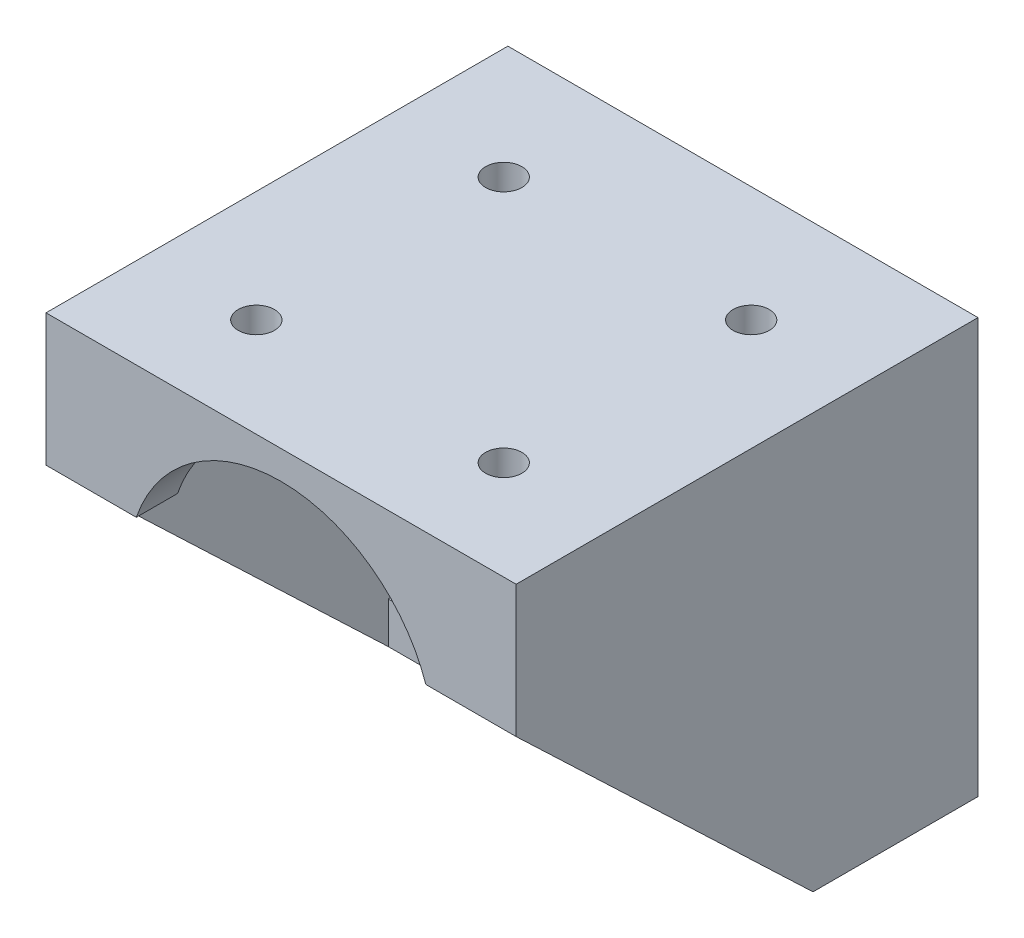
from build123d import *

# Parameters (mm, degrees)
ESQUISSE1_W             = 46
ESQUISSE1_H             = 47
ESQUISSE1_R             = 2.2
BOSS_EXTRU_1_DEPTH      = 5
BOSS_EXTRU_2_START      = -5
BOSS_EXTRU_2_DEPTH      = 45.3
ESQUISSE3_R             = 6.5
ESQUISSE3_R_2           = 1.6
ENL_V_MAT_EXTRU_1_DEPTH = 15
ESQUISSE4_W             = 57
ESQUISSE4_H             = 5
BOSS_EXTRU_3_DEPTH      = 20
ESQUISSE7_W             = 57
ESQUISSE7_H             = 5
BOSS_EXTRU_4_DEPTH      = 16
ESQUISSE8_R             = 18.55
ENL_V_MAT_EXTRU_3_DEPTH = 52
ENL_V_MAT_EXTRU_4_DEPTH = 10
ENL_V_MAT_EXTRU_5_DEPTH = 10
BOSS_EXTRU_6_DEPTH      = 5.5
BOSS_EXTRU_7_START      = -5.5
BOSS_EXTRU_7_DEPTH      = 5.5
ESQUISSE14_R            = 2.2
ENL_V_MAT_EXTRU_6_DEPTH = 10


with BuildPart() as part:
    # Esquisse1 → Boss.-Extru.1 (new body)
    with BuildSketch(Plane(origin=(0, 0, 0), x_dir=(1, 0, 0), z_dir=(0, 1, 0))):
        Rectangle(ESQUISSE1_W, ESQUISSE1_H)
        with Locations(Location((-15, 13.5, 0), (0, 0, 270))):
            Circle(ESQUISSE1_R, mode=Mode.SUBTRACT)
        with Locations(Location((-15, -16.5, 0), (0, 0, 270))):
            Circle(ESQUISSE1_R, mode=Mode.SUBTRACT)
        with Locations(Location((15, -16.5, 0), (0, 0, 270))):
            Circle(ESQUISSE1_R, mode=Mode.SUBTRACT)
        with Locations(Location((15, 13.5, 0), (0, 0, 270))):
            Circle(ESQUISSE1_R, mode=Mode.SUBTRACT)
    extrude(amount=BOSS_EXTRU_1_DEPTH)

    # Esquisse2 → Boss.-Extru.2 (add)
    with BuildSketch(Plane.XZ.offset(BOSS_EXTRU_2_START)):
        Polygon((-28.5, -27.5), (-28.5, 23.5), (-23, 23.5), (-23, -23.5), (23, -23.5), (23, 23.5), (28.5, 23.5), (28.5, -27.5), align=None)
    extrude(amount=BOSS_EXTRU_2_DEPTH)

    # Esquisse3 → Enlèv. mat.-Extru.1 (cut)
    with BuildSketch(Plane.XY.offset(-23.5)):
        with Locations((0, -10)):
            Circle(ESQUISSE3_R)
        with Locations((7.75, -30.423393759)):
            Circle(ESQUISSE3_R_2)
        with Locations((-7.75, -30.423393759)):
            Circle(ESQUISSE3_R_2)
        with Locations((-15.5, -17)):
            Circle(ESQUISSE3_R_2)
        with Locations((-7.75, -3.576606241)):
            Circle(ESQUISSE3_R_2)
        with Locations((7.75, -3.576606241)):
            Circle(ESQUISSE3_R_2)
        with Locations((15.5, -17)):
            Circle(ESQUISSE3_R_2)
    extrude(amount=-ENL_V_MAT_EXTRU_1_DEPTH, mode=Mode.SUBTRACT)

    # Esquisse4 → Boss.-Extru.3 (add)
    with BuildSketch(Plane(origin=(0, 0, -27.5), x_dir=(-1, 0, 0), z_dir=(0, 0, -1))):
        with Locations((0, -42.8)):
            Rectangle(ESQUISSE4_W, ESQUISSE4_H)
    extrude(amount=-BOSS_EXTRU_3_DEPTH)

    # Esquisse7 → Boss.-Extru.4 (add)
    with BuildSketch(Plane(origin=(0, 5, 0), x_dir=(1, 0, 0), z_dir=(0, 1, 0))):
        with Locations((0, -26)):
            Rectangle(ESQUISSE7_W, ESQUISSE7_H)
    extrude(amount=-BOSS_EXTRU_4_DEPTH)

    # Esquisse8 → Enlèv. mat.-Extru.3 (cut)
    with BuildSketch(Plane.XY.offset(28.5)):
        with Locations((0, -17)):
            Circle(ESQUISSE8_R)
    extrude(amount=-ENL_V_MAT_EXTRU_3_DEPTH, mode=Mode.SUBTRACT)

    # Esquisse10 → Enlèv. mat.-Extru.4 (cut)
    with BuildSketch(Plane(origin=(28.5, 0, 0), x_dir=(0, 0, -1), z_dir=(1, 0, 0))):
        Polygon((-23.5, -11), (7.5, -40.3), (-23.5, -40.3), align=None)
    extrude(amount=-ENL_V_MAT_EXTRU_4_DEPTH, mode=Mode.SUBTRACT)

    # Esquisse11 → Enlèv. mat.-Extru.5 (cut)
    with BuildSketch(Plane.ZY.offset(28.5)):
        Polygon((23.5, -11), (-7.5, -40.3), (23.5, -40.3), align=None)
    extrude(amount=-ENL_V_MAT_EXTRU_5_DEPTH, mode=Mode.SUBTRACT)

    # Esquisse12 → Boss.-Extru.6 (add)
    with BuildSketch(Plane.ZY.offset(28.5)):
        Polygon((-7.5, -45.3), (28.5, -11), (23.5, -11), (-7.5, -40.3), align=None)
    extrude(amount=-BOSS_EXTRU_6_DEPTH)

    # Esquisse13 → Boss.-Extru.7 (add)
    with BuildSketch(Plane(origin=(28.5, 0, 0), x_dir=(0, 0, -1), z_dir=(1, 0, 0)).offset(BOSS_EXTRU_7_START)):
        Polygon((-28.5, -11), (7.5, -45.3), (7.5, -40.3), (-23.5, -11), align=None)
    extrude(amount=BOSS_EXTRU_7_DEPTH)

    # Esquisse14 → Enlèv. mat.-Extru.6 (cut)
    with BuildSketch(Plane.XZ.offset(45.3)):
        with Locations(Location((-14.5, -17.5, 0), (0, 0, 270))):
            Circle(ESQUISSE14_R)
        with Locations(Location((14.5, -17.5, 0), (0, 0, 270))):
            Circle(ESQUISSE14_R)
    extrude(amount=-ENL_V_MAT_EXTRU_6_DEPTH, mode=Mode.SUBTRACT)


solid = part.part
